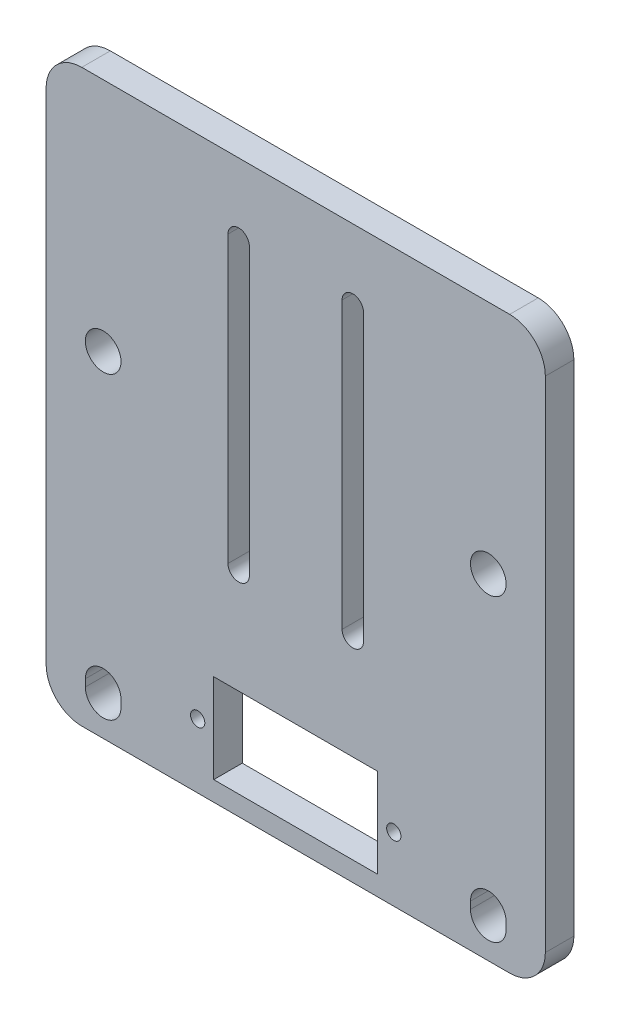
from build123d import *

# Parameters (mm, degrees)
SKETCH4_W           = 70
SKETCH4_H           = 80
SKETCH4_R           = 2.5
BOSS_EXTRUDE2_DEPTH = 4
FILLET1_R           = 5
SKETCH6_R           = 1
SKETCH6_W           = 23
SKETCH6_H           = 12.5
CUT_EXTRUDE1_DEPTH  = 54.301031885


with BuildPart() as part:
    # Sketch4 → Boss-Extrude2 (new body)
    with BuildSketch(Plane.XY):
        Rectangle(SKETCH4_W, SKETCH4_H)
        with Locations((-27, 7)):
            Circle(SKETCH4_R, mode=Mode.SUBTRACT)
        with Locations(Location((27, 7, 0), (0, 0, 180))):
            Circle(SKETCH4_R, mode=Mode.SUBTRACT)
        with BuildLine():
            Line((-24.5, -34), (-24.5, -35))
            ThreePointArc((-24.5, -35), (-27, -37.5), (-29.5, -35))
            Line((-29.5, -35), (-29.5, -34))
            ThreePointArc((-29.5, -34), (-27, -31.5), (-24.5, -34))
        make_face(mode=Mode.SUBTRACT)
        with BuildLine():
            Line((24.5, -34), (24.5, -35))
            ThreePointArc((24.5, -35), (27, -37.5), (29.5, -35))
            Line((29.5, -35), (29.5, -34))
            ThreePointArc((29.5, -34), (27, -31.5), (24.5, -34))
        make_face(mode=Mode.SUBTRACT)
    extrude(amount=BOSS_EXTRUDE2_DEPTH)

    # Fillet1
    fillet1_edges = [part.edges().sort_by_distance(p)[0] for p in [
        (35, -40, 2),
        (-35, -40, 2),
        (-35, 40, 2),
        (35, 40, 2),
    ]]
    fillet(fillet1_edges, radius=FILLET1_R)

    # Sketch6 → Cut-Extrude1 (cut, through all)
    with BuildSketch(Plane.XY.offset(4)):
        with Locations((-13.75, -31)):
            Circle(SKETCH6_R)
        with Locations(Location((13.75, -31, 0), (0, 0, 180))):
            Circle(SKETCH6_R)
        with Locations((0, -31)):
            Rectangle(SKETCH6_W, SKETCH6_H)
        with BuildLine():
            Line((-6.5, 30), (-6.5, -10))
            ThreePointArc((-6.5, -10), (-8, -11.5), (-9.5, -10))
            Line((-9.5, -10), (-9.5, 30))
            ThreePointArc((-9.5, 30), (-8, 31.5), (-6.5, 30))
        make_face()
        with BuildLine():
            Line((6.5, 30), (6.5, -10))
            ThreePointArc((6.5, -10), (8, -11.5), (9.5, -10))
            Line((9.5, -10), (9.5, 30))
            ThreePointArc((9.5, 30), (8, 31.5), (6.5, 30))
        make_face()
    extrude(amount=-CUT_EXTRUDE1_DEPTH, mode=Mode.SUBTRACT)


solid = part.part
